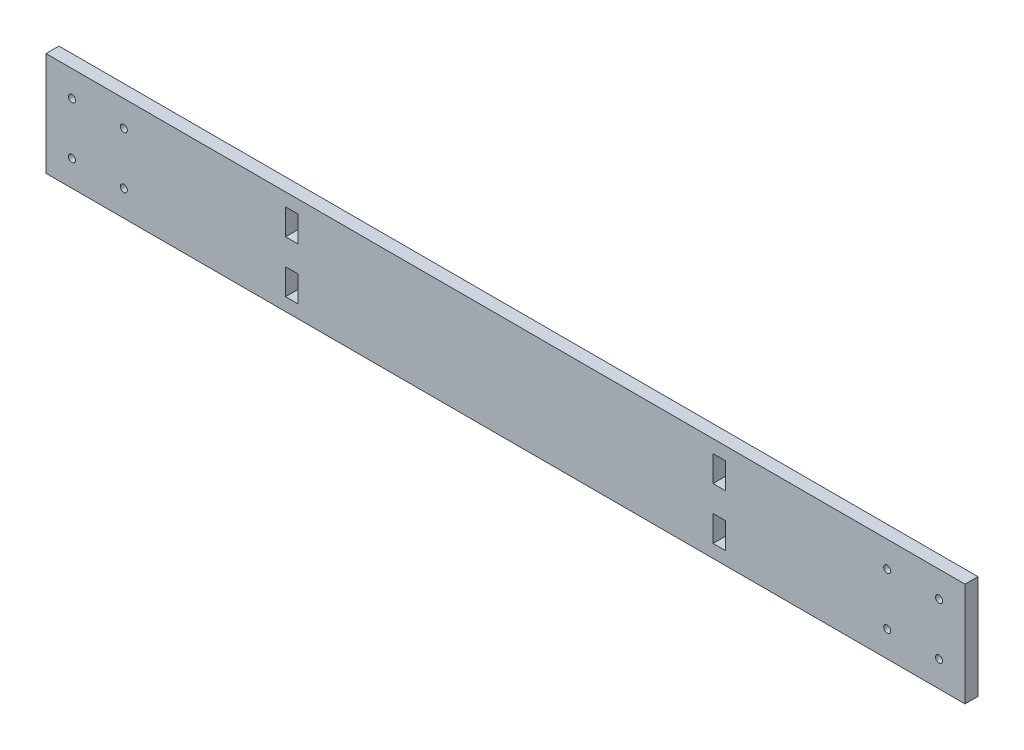
from build123d import *

# Parameters (mm, degrees)
SKETCH2_W             = 450.0499
SKETCH2_H             = 50.8
BOSS_EXTRUDE1_DEPTH   = 3.175
F_8_32_TAPPED_HOLE1_D = 3.4544
SKETCH5_W             = 6.096
SKETCH5_H             = 12.7
CUT_EXTRUDE1_DEPTH    = 227.542955358


with BuildPart() as part:
    # Sketch2 → Boss-Extrude1 (new, symmetric)
    with BuildSketch(Plane.XY):
        Rectangle(SKETCH2_W, SKETCH2_H)
    extrude(amount=BOSS_EXTRUDE1_DEPTH, both=True)

    # #8-32 Tapped Hole1 (through all)
    with Locations(Plane.XY.offset(3.175)):
        with Locations((-212.32495, 12.7), (-212.32495, -12.7), (212.32495, 12.7), (212.32495, -12.7), (-186.92495, 12.7), (-186.92495, -12.7), (186.92495, 12.7), (186.92495, -12.7)):
            Hole(F_8_32_TAPPED_HOLE1_D / 2)

    # Sketch5 → Cut-Extrude1 (cut, through all)
    with BuildSketch(Plane.XY.offset(3.175)):
        with Locations((-104.648, 12.7)):
            Rectangle(SKETCH5_W, SKETCH5_H)
        with Locations((-104.648, -12.7)):
            Rectangle(SKETCH5_W, SKETCH5_H)
        with Locations((104.648, 12.7)):
            Rectangle(SKETCH5_W, SKETCH5_H)
        with Locations((104.648, -12.7)):
            Rectangle(SKETCH5_W, SKETCH5_H)
    extrude(amount=-CUT_EXTRUDE1_DEPTH, mode=Mode.SUBTRACT)


solid = part.part
